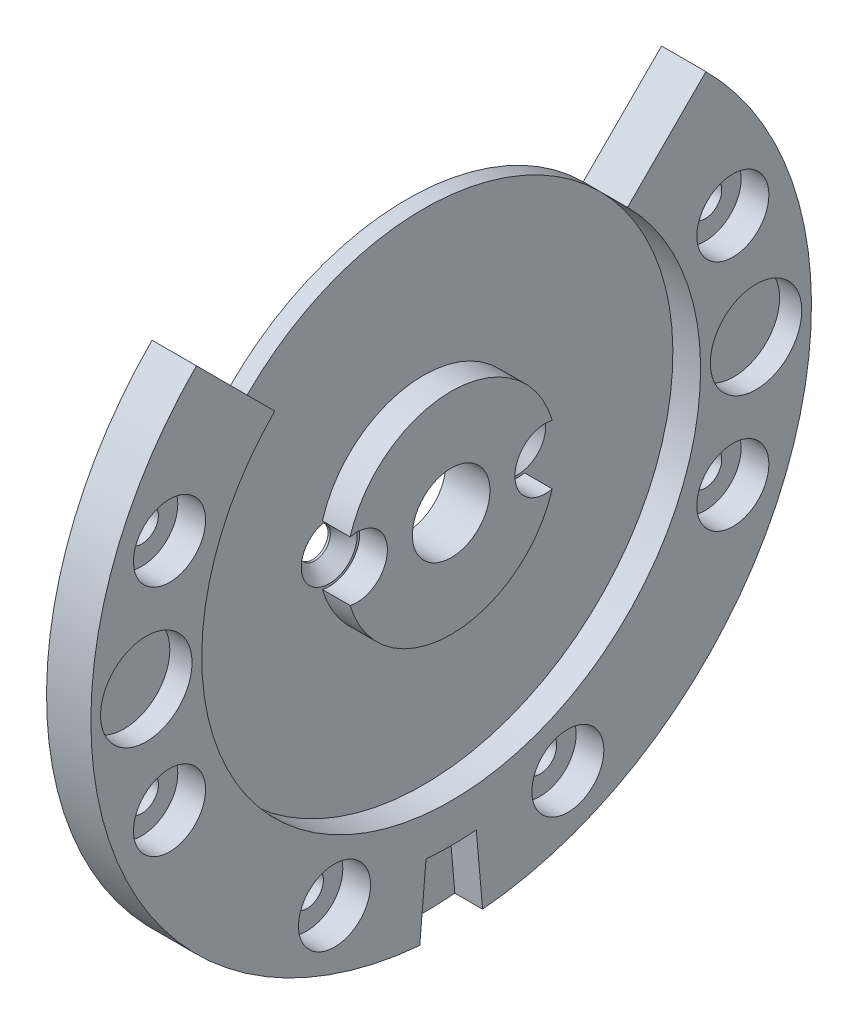
from build123d import *

# Parameters (mm, degrees)
CROQUIS2_R                                  = 3.5
CROQUIS2_R_2                                = 1.5
CORTAR_EXTRUIR1_DEPTH                       = 4
CORTAR_EXTRUIR2_DEPTH                       = 10
CORTAR_EXTRUIR3_START                       = -2.5
CORTAR_EXTRUIR3_DEPTH                       = 2.5
CORTAR_EXTRUIR4_DEPTH                       = 2
CROQUIS7_R                                  = 2.75
CROQUIS7_R_2                                = 3.25
CORTAR_EXTRUIR6_DEPTH                       = 2.5
AVELLANADO_PARA_TORNILLO_CON_CABEZA_2_COUNT = 2
AVELLANADO_PARA_TORNILLO_CON_CABEZA_2_PITCH = 17


with BuildPart() as part:
    # Croquis1 → Revolución1 (revolve)
    with BuildSketch(Plane.XY, mode=Mode.PRIVATE) as revoluci_n1_sk:
        Polygon((0, 0), (4, 0), (4, 9.5), (1.5, 9.5), (1.5, 22.5), (4, 22.5), (4, 32.5), (0, 32.5), align=None)
    revolve(revoluci_n1_sk.sketch.rotate(Axis((0, 0, 0), (1, 0, 0)), 90), axis=Axis((0, 0, 0), (1, 0, 0)))

    # Croquis2 → Cortar-Extruir1 (cut)
    with BuildSketch(Plane(origin=(4, 0, 0), x_dir=(0, 0, -1), z_dir=(1, 0, 0))):
        Circle(CROQUIS2_R)
        with Locations((25.406687144, -10.52379439)):
            Circle(CROQUIS2_R_2)
        with Locations((10.52379439, -25.406687144)):
            Circle(CROQUIS2_R_2)
        with Locations((-10.52379439, -25.406687144)):
            Circle(CROQUIS2_R_2)
        with Locations((-25.406687144, -10.52379439)):
            Circle(CROQUIS2_R_2)
        with Locations((-25.406687144, 10.52379439)):
            Circle(CROQUIS2_R_2)
        with Locations((25.406687144, 10.52379439)):
            Circle(CROQUIS2_R_2)
    extrude(amount=-CORTAR_EXTRUIR1_DEPTH, mode=Mode.SUBTRACT)

    # Croquis3 → Cortar-Extruir2 (cut)
    with BuildSketch(Plane(origin=(4, 0, 0), x_dir=(0, 0, -1), z_dir=(1, 0, 0))):
        with BuildLine():
            Line((-22.980970389, 22.980970389), (-15.909902577, 15.909902577))
            ThreePointArc((-15.909902577, 15.909902577), (0, 22.5), (15.909902577, 15.909902577))
            Line((15.909902577, 15.909902577), (22.980970389, 22.980970389))
            ThreePointArc((22.980970389, 22.980970389), (0, 32.5), (-22.980970389, 22.980970389))
        make_face()
    extrude(amount=-CORTAR_EXTRUIR2_DEPTH, mode=Mode.SUBTRACT)

    # Croquis4 → Cortar-Extruir3 (cut)
    with BuildSketch(Plane(origin=(4, 0, 0), x_dir=(0, 0, -1), z_dir=(1, 0, 0)).offset(CORTAR_EXTRUIR3_START)):
        with BuildLine():
            Line((2.832561639, -32.376327688), (2.266049311, -25.90106215))
            ThreePointArc((2.266049311, -25.90106215), (0, -26), (-2.266049311, -25.90106215))
            Line((-2.266049311, -25.90106215), (-2.832561639, -32.376327688))
            ThreePointArc((-2.832561639, -32.376327688), (0, -32.5), (2.832561639, -32.376327688))
        make_face()
    extrude(amount=CORTAR_EXTRUIR3_DEPTH, mode=Mode.SUBTRACT)

    # Croquis5 → Cortar-Extruir4 (cut)
    with BuildSketch(Plane(origin=(4, 0, 0), x_dir=(0, 0, -1), z_dir=(1, 0, 0))):
        with BuildLine():
            ThreePointArc((31.625, 0), (27.5, 4.125), (23.375, 0))
            Line((23.375, 0), (31.625, 0))
        make_face()
        with BuildLine():
            Line((31.625, 0), (23.375, 0))
            ThreePointArc((23.375, 0), (27.5, -4.125), (31.625, 0))
        make_face()
        with BuildLine():
            ThreePointArc((-31.625, 0), (-27.5, -4.125), (-23.375, 0))
            Line((-23.375, 0), (-31.625, 0))
        make_face()
        with BuildLine():
            Line((-31.625, 0), (-23.375, 0))
            ThreePointArc((-23.375, 0), (-27.5, 4.125), (-31.625, 0))
        make_face()
    extrude(amount=-CORTAR_EXTRUIR4_DEPTH, mode=Mode.SUBTRACT)

    # Croquis7 → Cortar-Extruir6 (cut)
    with BuildSketch(Plane(origin=(4, 0, 0), x_dir=(0, 0, -1), z_dir=(1, 0, 0))):
        with Locations((8.5, 0)):
            Circle(CROQUIS7_R)
        with Locations((-8.5, 0)):
            Circle(CROQUIS7_R)
        with Locations((25.406687144, -10.52379439)):
            Circle(CROQUIS7_R_2)
        with Locations((10.52379439, -25.406687144)):
            Circle(CROQUIS7_R_2)
        with Locations((-10.52379439, -25.406687144)):
            Circle(CROQUIS7_R_2)
        with Locations((-25.406687144, -10.52379439)):
            Circle(CROQUIS7_R_2)
        with Locations((-25.406687144, 10.52379439)):
            Circle(CROQUIS7_R_2)
        with Locations((25.406687144, 10.52379439)):
            Circle(CROQUIS7_R_2)
    extrude(amount=-CORTAR_EXTRUIR6_DEPTH, mode=Mode.SUBTRACT)

    # Croquis10 → Avellanado para tornillo con cabeza ovalada de #31 (revolve, cut)
    with BuildSketch(Plane(origin=(1.5, 0, 8.5), x_dir=(0, 0, -1), z_dir=(0, 1, 0))):
        Polygon((0, 0), (0, 1.5), (1.397, 1.5), (1.397, 1.300261411), (2.5273, 0), align=None)
    avellanado_para_tornillo_con_cabeza_oval = revolve(axis=Axis((7.85, 0, 8.5), (-1, 0, 0)), mode=Mode.SUBTRACT)

    # Avellanado para tornillo con cabeza  2: Avellanado para tornillo con cabeza ovalada de #31 ×2
    with Locations(*[(0, 0, -i * AVELLANADO_PARA_TORNILLO_CON_CABEZA_2_PITCH) for i in range(1, AVELLANADO_PARA_TORNILLO_CON_CABEZA_2_COUNT)]):
        add(avellanado_para_tornillo_con_cabeza_oval, mode=Mode.SUBTRACT)


solid = part.part
